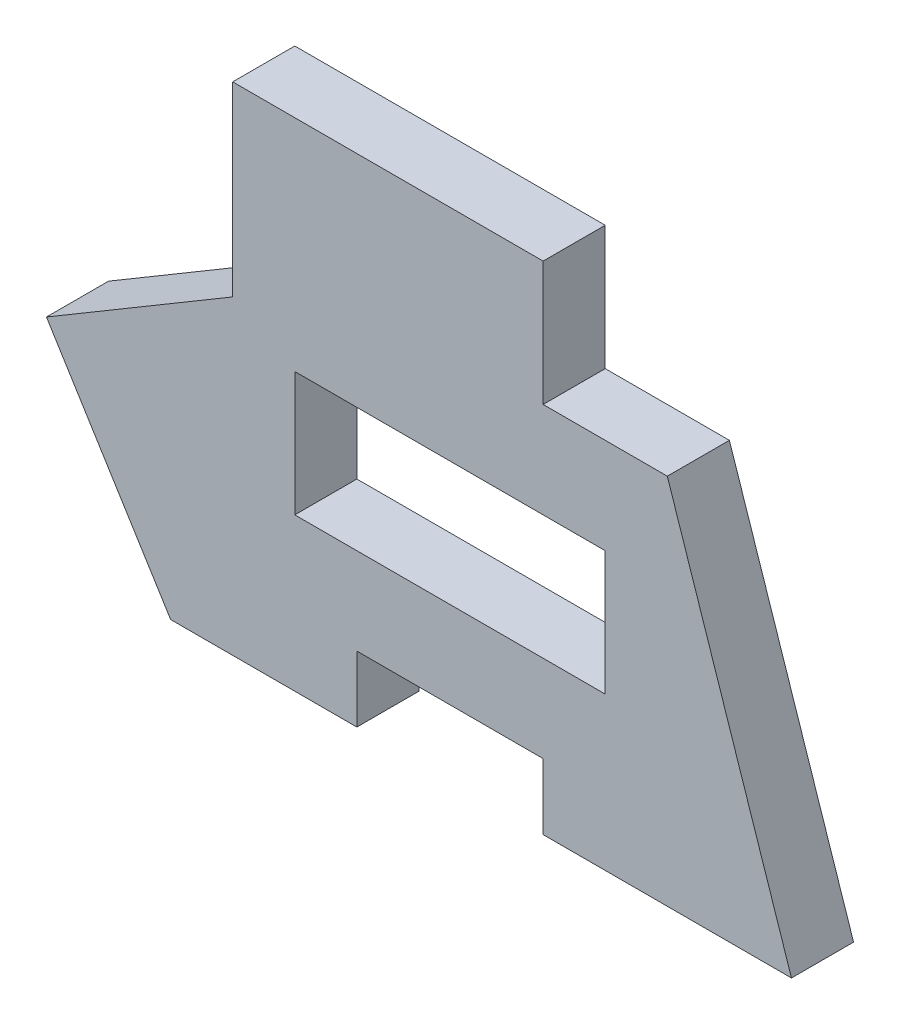
from build123d import *

# Parameters (mm, degrees)
SKETCH1_W           = 250
SKETCH1_H           = 100
BOSS_EXTRUDE1_DEPTH = 50


with BuildPart() as part:
    # Sketch1 → Boss-Extrude1 (new body)
    with BuildSketch(Plane.XY):
        Polygon((-275, -38.669266581), (-175, -199.669266581), (-25, -199.669266581), (-25, -146.669266581), (125, -146.669266581), (125, -199.669266581), (325, -199.669266581), (225, 100.330733419), (125, 100.330733419), (125, 200.330733419), (-125, 200.330733419), (-125, 50.330733419), align=None)
        with Locations((50, -26.669266581)):
            Rectangle(SKETCH1_W, SKETCH1_H, mode=Mode.SUBTRACT)
    extrude(amount=BOSS_EXTRUDE1_DEPTH)


solid = part.part
